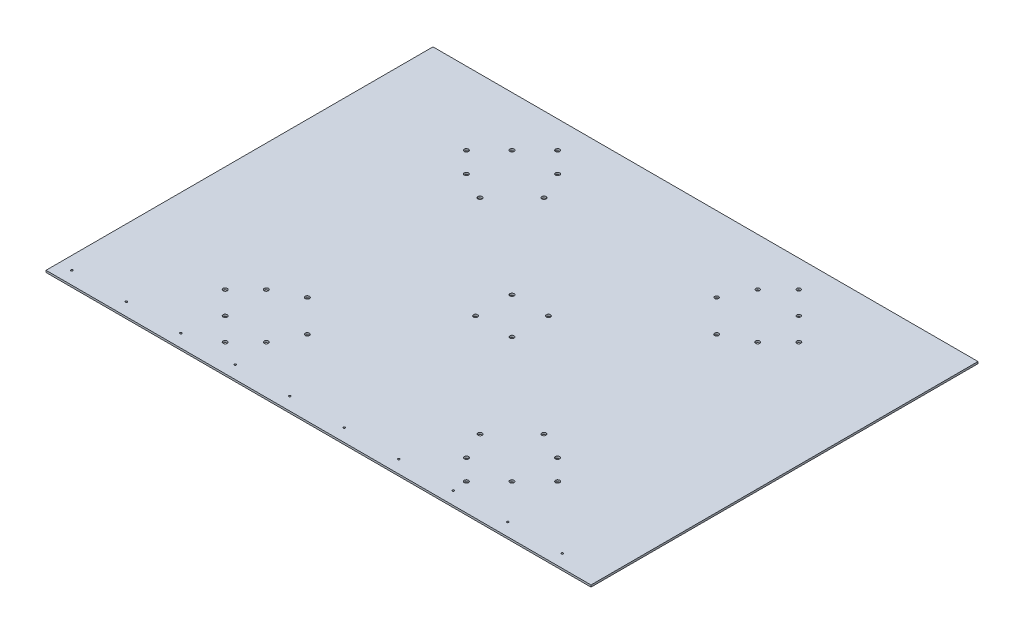
from build123d import *

# Parameters (mm, degrees)
SKETCH2_W           = 845
SKETCH2_H           = 600
SKETCH2_R           = 3.3
SKETCH2_R_2         = 3.25
SKETCH2_R_3         = 3
BOSS_EXTRUDE2_DEPTH = 3
SKETCH5_R           = 1.5
CUT_EXTRUDE1_DEPTH  = 10


with BuildPart() as part:
    # Sketch2 → Boss-Extrude2 (new body)
    with BuildSketch(Plane(origin=(0, 1310.548413309, 0), x_dir=(1, 0, 0), z_dir=(0, 1, 0))):
        with Locations((1065.777273447, -1504.227226955)):
            Rectangle(SKETCH2_W, SKETCH2_H)
        with Locations(Location((843.462901442, -1726.54159896, 0), (0, 0, 180))):
            Circle(SKETCH2_R, mode=Mode.SUBTRACT)
        with Locations(Location((878.818240502, -1761.896938019, 0), (0, 0, 180))):
            Circle(SKETCH2_R, mode=Mode.SUBTRACT)
        with Locations(Location((910.638045655, -1730.077132866, 0), (0, 0, 180))):
            Circle(SKETCH2_R, mode=Mode.SUBTRACT)
        with Locations(Location((808.107562383, -1691.186259901, 0), (0, 0, 180))):
            Circle(SKETCH2_R, mode=Mode.SUBTRACT)
        with Locations(Location((839.927367536, -1659.366454747, 0), (0, 0, 180))):
            Circle(SKETCH2_R, mode=Mode.SUBTRACT)
        with Locations(Location((931.851249091, -1687.650725995, 0), (0, 0, 180))):
            Circle(SKETCH2_R, mode=Mode.SUBTRACT)
        with Locations(Location((882.353774408, -1638.153251312, 0), (0, 0, 180))):
            Circle(SKETCH2_R, mode=Mode.SUBTRACT)
        with Locations(Location((1037.4930022, -1532.511498202, 0), (0, 0, 180))):
            Circle(SKETCH2_R_2, mode=Mode.SUBTRACT)
        with Locations(Location((1252.736306393, -1761.896938019, 0), (0, 0, 180))):
            Circle(SKETCH2_R, mode=Mode.SUBTRACT)
        with Locations(Location((1220.91650124, -1730.077132866, 0), (0, 0, 180))):
            Circle(SKETCH2_R, mode=Mode.SUBTRACT)
        with Locations(Location((1288.091645453, -1726.54159896, 0), (0, 0, 180))):
            Circle(SKETCH2_R, mode=Mode.SUBTRACT)
        with Locations(Location((1199.703297804, -1687.650725995, 0), (0, 0, 180))):
            Circle(SKETCH2_R, mode=Mode.SUBTRACT)
        with Locations(Location((1249.200772487, -1638.153251312, 0), (0, 0, 180))):
            Circle(SKETCH2_R, mode=Mode.SUBTRACT)
        with Locations(Location((1323.446984512, -1691.186259901, 0), (0, 0, 180))):
            Circle(SKETCH2_R, mode=Mode.SUBTRACT)
        with Locations(Location((1291.627179358, -1659.366454747, 0), (0, 0, 180))):
            Circle(SKETCH2_R, mode=Mode.SUBTRACT)
        with Locations(Location((1094.061544695, -1532.511498202, 0), (0, 0, 180))):
            Circle(SKETCH2_R_2, mode=Mode.SUBTRACT)
        with Locations(Location((1037.4930022, -1475.942955707, 0), (0, 0, 180))):
            Circle(SKETCH2_R_2, mode=Mode.SUBTRACT)
        with Locations(Location((839.927367536, -1349.087999163, 0), (0, 0, 180))):
            Circle(SKETCH2_R, mode=Mode.SUBTRACT)
        with Locations(Location((808.107562383, -1317.268194009, 0), (0, 0, 180))):
            Circle(SKETCH2_R, mode=Mode.SUBTRACT)
        with Locations(Location((882.353774408, -1370.301202598, 0), (0, 0, 180))):
            Circle(SKETCH2_R, mode=Mode.SUBTRACT)
        with Locations(Location((931.851249091, -1320.803727915, 0), (0, 0, 180))):
            Circle(SKETCH2_R, mode=Mode.SUBTRACT)
        with Locations(Location((843.462901442, -1281.91285495, 0), (0, 0, 180))):
            Circle(SKETCH2_R, mode=Mode.SUBTRACT)
        with Locations(Location((910.638045655, -1278.377321044, 0), (0, 0, 180))):
            Circle(SKETCH2_R, mode=Mode.SUBTRACT)
        with Locations(Location((878.818240502, -1246.55751589, 0), (0, 0, 180))):
            Circle(SKETCH2_R, mode=Mode.SUBTRACT)
        with Locations(Location((1094.061544695, -1475.942955707, 0), (0, 0, 180))):
            Circle(SKETCH2_R_2, mode=Mode.SUBTRACT)
        with Locations(Location((1249.200772487, -1370.301202598, 0), (0, 0, 180))):
            Circle(SKETCH2_R, mode=Mode.SUBTRACT)
        with Locations(Location((1291.627179359, -1349.087999162, 0), (0, 0, 180))):
            Circle(SKETCH2_R, mode=Mode.SUBTRACT)
        with Locations(Location((1323.446984512, -1317.268194009, 0), (0, 0, 180))):
            Circle(SKETCH2_R, mode=Mode.SUBTRACT)
        with Locations(Location((1220.91650124, -1278.377321044, 0), (0, 0, 180.000000001))):
            Circle(SKETCH2_R_3, mode=Mode.SUBTRACT)
        with Locations(Location((1252.736306393, -1246.55751589, 0), (0, 0, 180.000000001))):
            Circle(SKETCH2_R_3, mode=Mode.SUBTRACT)
        with Locations(Location((1288.091645453, -1281.91285495, 0), (0, 0, 180.000000001))):
            Circle(SKETCH2_R_3, mode=Mode.SUBTRACT)
        with Locations(Location((1199.703297804, -1320.803727915, 0), (0, 0, 180.000000001))):
            Circle(SKETCH2_R_3, mode=Mode.SUBTRACT)
    extrude(amount=BOSS_EXTRUDE2_DEPTH)

    # Sketch5 → Cut-Extrude1 (cut)
    with BuildSketch(Plane.XZ.offset(-1310.548413309)):
        with Locations((663.277273447, 1784.227226955)):
            Circle(SKETCH5_R)
        with Locations((747.777273447, 1784.227226955)):
            Circle(SKETCH5_R)
        with Locations((832.277273447, 1784.227226955)):
            Circle(SKETCH5_R)
        with Locations((916.777273447, 1784.227226955)):
            Circle(SKETCH5_R)
        with Locations((1001.277273447, 1784.227226955)):
            Circle(SKETCH5_R)
        with Locations((1085.777273447, 1784.227226955)):
            Circle(SKETCH5_R)
        with Locations((1170.277273447, 1784.227226955)):
            Circle(SKETCH5_R)
        with Locations((1254.777273447, 1784.227226955)):
            Circle(SKETCH5_R)
        with Locations((1339.277273447, 1784.227226955)):
            Circle(SKETCH5_R)
        with Locations((1423.777273447, 1784.227226955)):
            Circle(SKETCH5_R)
    extrude(amount=-CUT_EXTRUDE1_DEPTH, mode=Mode.SUBTRACT)


solid = part.part
